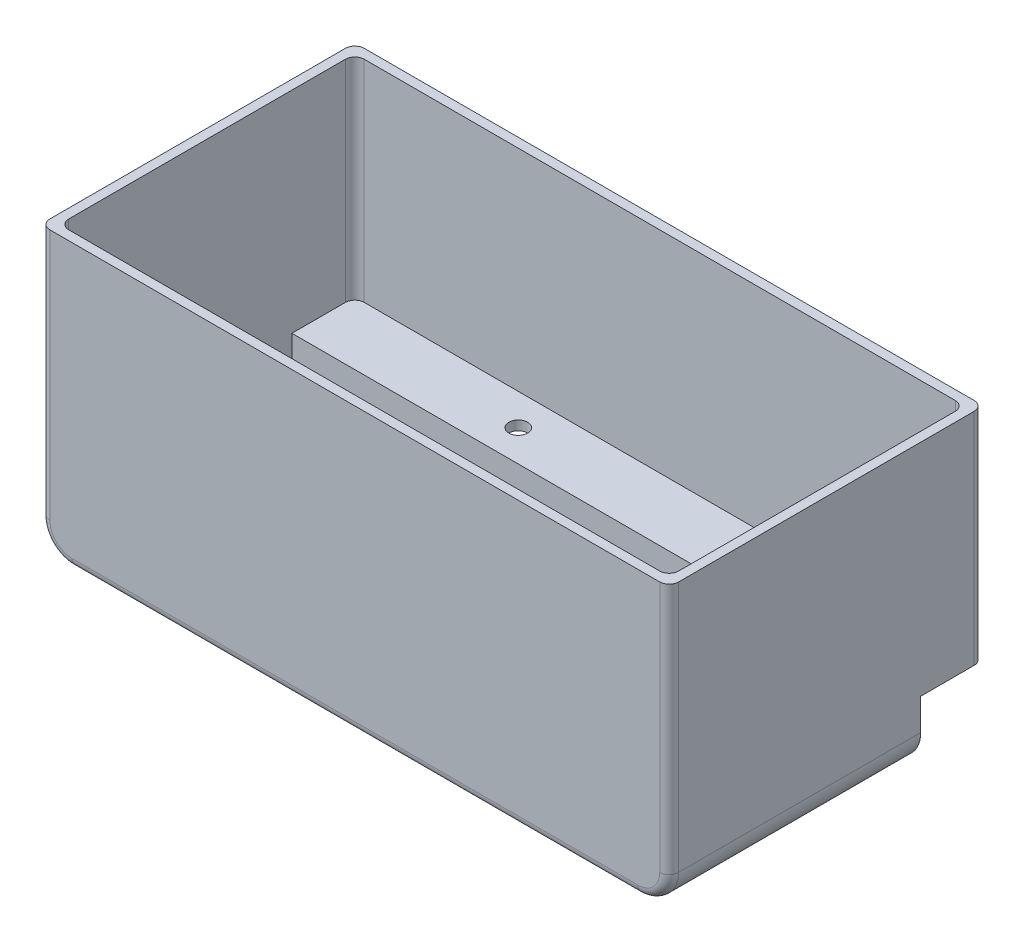
from build123d import *

# Parameters (mm, degrees)
SKETCH_1_W          = 200
SKETCH_1_H          = 100
EXTRUDE_1_DEPTH     = 90
SKETCH_2_W          = 20
SKETCH_2_H          = 20
CUT_EXTRUDE_1_DEPTH = 200
FILLET_1_R          = 10
SHELL_1_T           = -3
FILLET_2_R          = 3
SKETCH_3_R          = 3
CUT_EXTRUDE_2_DEPTH = 3


with BuildPart() as part:
    # 草圖1 → 填料-伸長1 (new body)
    with BuildSketch(Plane(origin=(0, 0, 0), x_dir=(1, 0, 0), z_dir=(0, 1, 0))):
        Rectangle(SKETCH_1_W, SKETCH_1_H)
    extrude(amount=EXTRUDE_1_DEPTH)

    # 草圖2 → 除料-伸長1 (cut)
    with BuildSketch(Plane(origin=(100, 0, 0), x_dir=(0, 0, -1), z_dir=(1, 0, 0))):
        with Locations((40, 10)):
            Rectangle(SKETCH_2_W, SKETCH_2_H)
    extrude(amount=-CUT_EXTRUDE_1_DEPTH, mode=Mode.SUBTRACT)

    # 圓角1
    fillet_1_edges = [part.edges().sort_by_distance(p)[0] for p in [
        (-100, 0, 10),
        (100, 0, 10),
    ]]
    fillet(fillet_1_edges, radius=FILLET_1_R)

    # 薄殼1
    shell_1_openings = [part.faces().sort_by_distance(p)[0] for p in [
        (0, 90, 0),
    ]]
    offset(amount=SHELL_1_T, openings=shell_1_openings, kind=Kind.INTERSECTION)

    # 圓角2
    fillet_2_edges = [part.edges().sort_by_distance(p)[0] for p in [
        (0, 0, 50),
        (97.071067812, 2.928932188, 50),
        (-97.071067812, 2.928932188, 50),
        (97, 50, 47),
        (97, 56.5, -47),
        (-97, 56.5, -47),
        (-97, 50, 47),
        (-94.949747468, 5.050252532, 47),
        (0, 3, 47),
        (94.949747468, 5.050252532, 47),
        (100, 50, 50),
        (-100, 50, 50),
        (-100, 55, -50),
        (100, 55, -50),
    ]]
    fillet(fillet_2_edges, radius=FILLET_2_R)

    # 草圖3 → 除料-伸長2 (cut)
    with BuildSketch(Plane(origin=(0, 23, 0), x_dir=(1, 0, 0), z_dir=(0, 1, 0))):
        with Locations(Location((-35, 37, 0), (0, 0, 270))):
            Circle(SKETCH_3_R)
        with Locations(Location((35, 37, 0), (0, 0, 270))):
            Circle(SKETCH_3_R)
    extrude(amount=-CUT_EXTRUDE_2_DEPTH, mode=Mode.SUBTRACT)


solid = part.part
